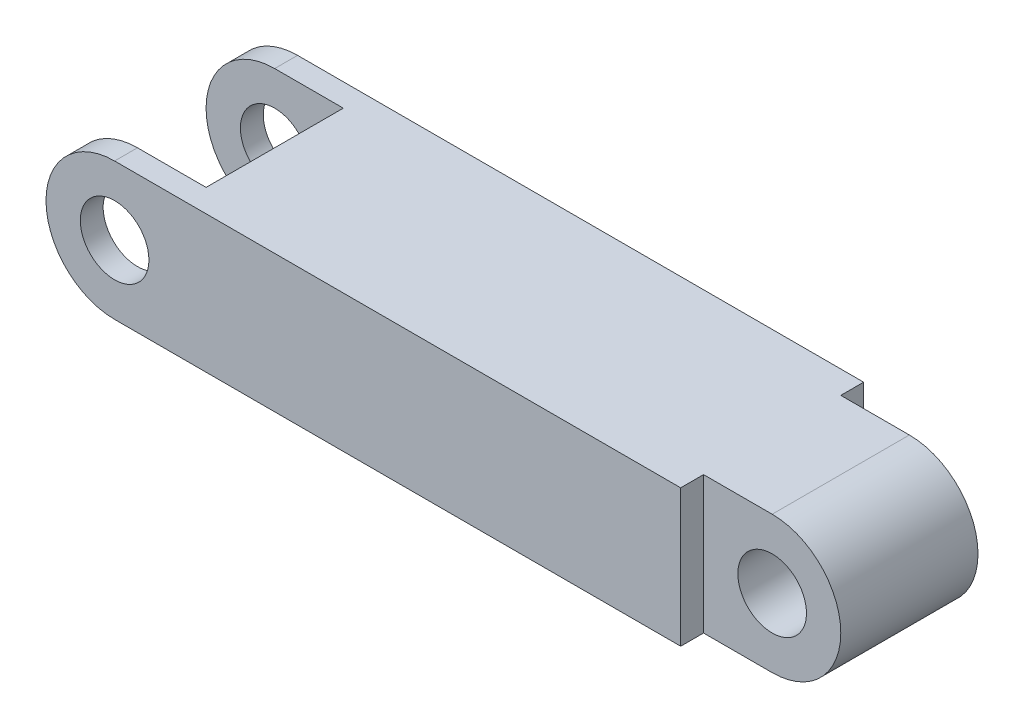
from build123d import *

# Parameters (mm, degrees)
SKETCH1_R           = 7.5
BOSS_EXTRUDE1_DEPTH = 40
SKETCH2_W           = 30
SKETCH2_H           = 30
SKETCH2_H_2         = 5
CUT_EXTRUDE1_DEPTH  = 162.686727154


with BuildPart() as part:
    # Sketch1 → Boss-Extrude1 (new body)
    with BuildSketch(Plane.XY):
        with BuildLine():
            Line((0, 15), (138.761496278, 15))
            ThreePointArc((138.761496278, 15), (153.761496278, 0), (138.761496278, -15))
            Line((138.761496278, -15), (0, -15))
            ThreePointArc((0, -15), (-15, 0), (0, 15))
        make_face()
        Circle(SKETCH1_R, mode=Mode.SUBTRACT)
        with Locations((138.761496278, 0)):
            Circle(SKETCH1_R, mode=Mode.SUBTRACT)
    extrude(amount=BOSS_EXTRUDE1_DEPTH)

    # Sketch2 → Cut-Extrude1 (cut, through all)
    with BuildSketch(Plane(origin=(0, 15, 0), x_dir=(1, 0, 0), z_dir=(0, 1, 0))):
        with Locations((0, -20)):
            Rectangle(SKETCH2_W, SKETCH2_H)
        with Locations((138.761496278, -2.5)):
            Rectangle(SKETCH2_W, SKETCH2_H_2)
        with Locations((138.761496278, -37.5)):
            Rectangle(SKETCH2_W, SKETCH2_H_2)
    extrude(amount=-CUT_EXTRUDE1_DEPTH, mode=Mode.SUBTRACT)


solid = part.part
